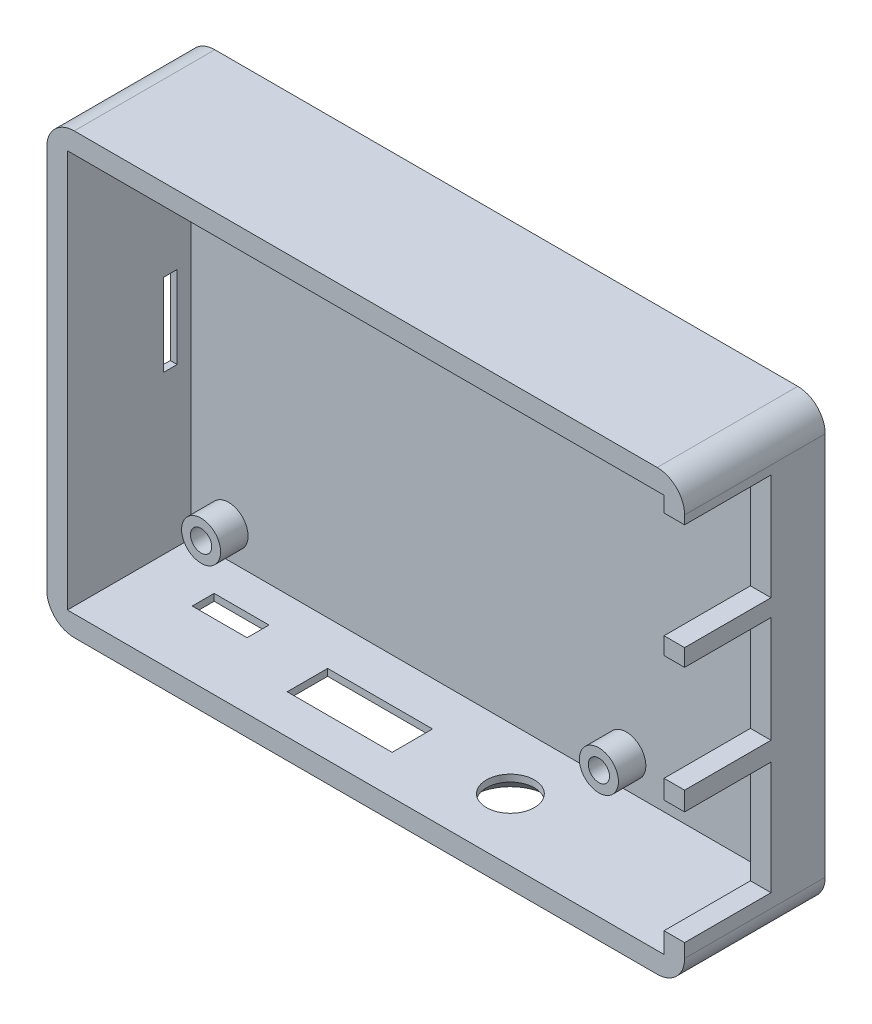
from build123d import *

# Parameters (mm, degrees)
BASE_SKETCH_W               = 93
BASE_SKETCH_H               = 64
BASE_DEPTH                  = 2.5
WALLS_SKETCH_W              = 93
WALLS_SKETCH_H              = 64
WALLS_SKETCH_W_2            = 87
WALLS_SKETCH_H_2            = 58
WALLS_DEPTH                 = 18
FRONT_CONNECTORS_REACH      = 102.465
FRONT_CONNECTORS_SKETCH_W   = 12.6
FRONT_CONNECTORS_SKETCH_H   = 16.5
FRONT_CONNECTORS_SKETCH_H_2 = 15.5
SIDE_CONNECTORS_REACH       = 83.722
SIDE_CONNECTORS_SKETCH_R    = 3.5
SIDE_CONNECTORS_SKETCH_W    = 8
SIDE_CONNECTORS_SKETCH_H    = 3.2
SIDE_CONNECTORS_SKETCH_W_2  = 15.3
SIDE_CONNECTORS_SKETCH_H_2  = 5.9
SIDE_CONNECTORS_ANGLE_SIZE  = 2
SD_SLOT_REACH               = 102.465
SD_SLOT_SKETCH_W            = 2
SD_SLOT_SKETCH_H            = 12
SD_SLOT_ANGLE_SIZE          = 2
MOUNT_PILLAR_SKETCH_R       = 2.85
MOUNT_PILLARS_DEPTH         = 4
INSERT_NUT_HOLES_D          = 3.1
INSERT_NUT_HOLES_DEPTH      = 5
INSERT_NUT_HOLES_TIP        = 0.931333959
ZAOBLIT2_R                  = 4


with BuildPart() as part:
    # Base sketch → Base (new body)
    with BuildSketch(Plane.XY):
        Rectangle(BASE_SKETCH_W, BASE_SKETCH_H)
    extrude(amount=BASE_DEPTH)

    # Walls sketch → Walls (add)
    with BuildSketch(Plane.XY.offset(2.5)):
        Rectangle(WALLS_SKETCH_W, WALLS_SKETCH_H)
        Rectangle(WALLS_SKETCH_W_2, WALLS_SKETCH_H_2, mode=Mode.SUBTRACT)
    extrude(amount=WALLS_DEPTH)

    # Front connectors sketch → Front connectors (cut, up to next)
    with BuildSketch(Plane(origin=(46.5, 0, 0), x_dir=(0, 0, -1), z_dir=(1, 0, 0)), mode=Mode.PRIVATE) as front_connectors_sk1:
        with Locations((-14.2, -17.75)):
            Rectangle(FRONT_CONNECTORS_SKETCH_W, FRONT_CONNECTORS_SKETCH_H)
    front_connectors_tool1 = extrude(front_connectors_sk1.sketch, amount=-FRONT_CONNECTORS_REACH, mode=Mode.PRIVATE) & part.part
    # Front connectors sketch → Front connectors (cut, up to next)
    with BuildSketch(Plane(origin=(46.5, 0, 0), x_dir=(0, 0, -1), z_dir=(1, 0, 0)), mode=Mode.PRIVATE) as front_connectors_sk2:
        with Locations((-14.2, 1)):
            Rectangle(FRONT_CONNECTORS_SKETCH_W, FRONT_CONNECTORS_SKETCH_H_2)
    front_connectors_tool2 = extrude(front_connectors_sk2.sketch, amount=-FRONT_CONNECTORS_REACH, mode=Mode.PRIVATE) & part.part
    # Front connectors sketch → Front connectors (cut, up to next)
    with BuildSketch(Plane(origin=(46.5, 0, 0), x_dir=(0, 0, -1), z_dir=(1, 0, 0)), mode=Mode.PRIVATE) as front_connectors_sk3:
        with Locations((-14.2, 19)):
            Rectangle(FRONT_CONNECTORS_SKETCH_W, FRONT_CONNECTORS_SKETCH_H_2)
    front_connectors_tool3 = extrude(front_connectors_sk3.sketch, amount=-FRONT_CONNECTORS_REACH, mode=Mode.PRIVATE) & part.part
    add(front_connectors_tool1.solids().sort_by_distance((46.5, -17.75, 14.2))[0], mode=Mode.SUBTRACT)
    add(front_connectors_tool2.solids().sort_by_distance((46.5, 1, 14.2))[0], mode=Mode.SUBTRACT)
    add(front_connectors_tool3.solids().sort_by_distance((46.5, 19, 14.2))[0], mode=Mode.SUBTRACT)

    # Side connectors sketch → Side connectors (cut, up to next)
    with BuildSketch(Plane.XZ.offset(32), mode=Mode.PRIVATE) as side_connectors_sk1:
        with Locations(Location((12, 11.4, 0), (0, 0, 270))):
            Circle(SIDE_CONNECTORS_SKETCH_R)
    side_connectors_tool1 = extrude(side_connectors_sk1.sketch, amount=-SIDE_CONNECTORS_REACH, mode=Mode.PRIVATE) & part.part
    # Side connectors sketch → Side connectors (cut, up to next)
    with BuildSketch(Plane.XZ.offset(32), mode=Mode.PRIVATE) as side_connectors_sk2:
        with Locations((-30.9, 9.3)):
            Rectangle(SIDE_CONNECTORS_SKETCH_W, SIDE_CONNECTORS_SKETCH_H)
    side_connectors_tool2 = extrude(side_connectors_sk2.sketch, amount=-SIDE_CONNECTORS_REACH, mode=Mode.PRIVATE) & part.part
    # Side connectors sketch → Side connectors (cut, up to next)
    with BuildSketch(Plane.XZ.offset(32), mode=Mode.PRIVATE) as side_connectors_sk3:
        with Locations((-9.5, 11.85)):
            Rectangle(SIDE_CONNECTORS_SKETCH_W_2, SIDE_CONNECTORS_SKETCH_H_2)
    side_connectors_tool3 = extrude(side_connectors_sk3.sketch, amount=-SIDE_CONNECTORS_REACH, mode=Mode.PRIVATE) & part.part
    add(side_connectors_tool1.solids().sort_by_distance((12, -32, 11.4))[0], mode=Mode.SUBTRACT)
    add(side_connectors_tool2.solids().sort_by_distance((-30.9, -32, 9.3))[0], mode=Mode.SUBTRACT)
    add(side_connectors_tool3.solids().sort_by_distance((-9.5, -32, 11.85))[0], mode=Mode.SUBTRACT)

    # Side connectors angle
    side_connectors_angle_edges = [part.edges().sort_by_distance(p)[0] for p in [
        (-9.5, -32, 8.9),
        (-1.85, -32, 11.85),
        (-9.5, -32, 14.8),
        (-17.15, -32, 11.85),
        (12, -32, 14.9),
        (-34.9, -32, 9.3),
        (-30.9, -32, 7.7),
        (-26.9, -32, 9.3),
        (-30.9, -32, 10.9),
    ]]
    chamfer(side_connectors_angle_edges, length=SIDE_CONNECTORS_ANGLE_SIZE)

    # SD slot sketch → SD slot (cut, up to next)
    with BuildSketch(Plane.ZY.offset(46.5), mode=Mode.PRIVATE) as sd_slot_sk1:
        with Locations((5.5, 0)):
            Rectangle(SD_SLOT_SKETCH_W, SD_SLOT_SKETCH_H)
    sd_slot_tool1 = extrude(sd_slot_sk1.sketch, amount=-SD_SLOT_REACH, mode=Mode.PRIVATE) & part.part
    add(sd_slot_tool1.solids().sort_by_distance((-46.5, 0, 5.5))[0], mode=Mode.SUBTRACT)

    # SD slot angle
    sd_slot_angle_edges = [part.edges().sort_by_distance(p)[0] for p in [
        (-46.5, 0, 6.5),
        (-46.5, -6, 5.5),
        (-46.5, 6, 5.5),
        (-46.5, 0, 4.5),
    ]]
    chamfer(sd_slot_angle_edges, length=SD_SLOT_ANGLE_SIZE)

    # Mount pillar sketch → Mount pillars (add)
    with BuildSketch(Plane.XY.offset(2.5)):
        with Locations((-38, -24.5)):
            Circle(MOUNT_PILLAR_SKETCH_R)
        with Locations((20, -24.5)):
            Circle(MOUNT_PILLAR_SKETCH_R)
        with Locations((20, 24.5)):
            Circle(MOUNT_PILLAR_SKETCH_R)
        with Locations((-38, 24.5)):
            Circle(MOUNT_PILLAR_SKETCH_R)
    extrude(amount=MOUNT_PILLARS_DEPTH)

    # Insert nut holes
    with Locations(Plane.XY.offset(6.5)):
        with Locations((-38, 24.5), (20, 24.5), (20, -24.5), (-38, -24.5)):
            Hole(INSERT_NUT_HOLES_D / 2, depth=INSERT_NUT_HOLES_DEPTH)
            with Locations((0, 0, -(INSERT_NUT_HOLES_DEPTH + INSERT_NUT_HOLES_TIP / 2))):  # 118° drill point
                Cone(0, INSERT_NUT_HOLES_D / 2, INSERT_NUT_HOLES_TIP, mode=Mode.SUBTRACT)

    # Zaoblit2
    zaoblit2_edges = [part.edges().sort_by_distance(p)[0] for p in [
        (46.5, 32, 10.25),
        (46.5, -32, 10.25),
        (-46.5, -32, 10.25),
        (-46.5, 32, 10.25),
    ]]
    fillet(zaoblit2_edges, radius=ZAOBLIT2_R)


solid = part.part
